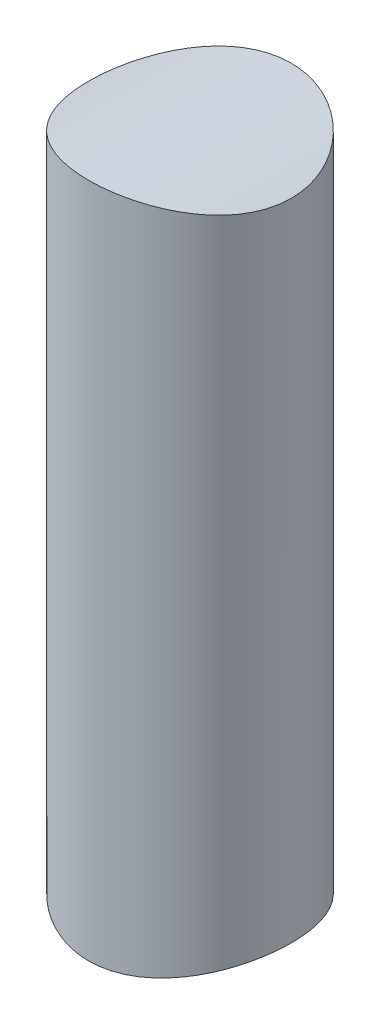
from build123d import *

# Parameters (mm, degrees)
CROQUIS1_R              = 2.5
SALIENTE_EXTRUIR1_DEPTH = 5
CROQUIS2_OUTSIDE_W      = 8.732
CROQUIS2_OUTSIDE_H      = 8.732
CROQUIS2_OUTSIDE_R      = 0.75
CORTAR_EXTRUIR1_DEPTH   = 2.5


with BuildPart() as part:
    # Croquis1 → Saliente-Extruir1 (new body)
    with BuildSketch(Plane.XY):
        Circle(CROQUIS1_R)
    extrude(amount=SALIENTE_EXTRUIR1_DEPTH)

    # Croquis2 outside → Cortar-Extruir1 (cut, symmetric)
    with BuildSketch(Plane(origin=(0, 0, 0), x_dir=(1, 0, 0), z_dir=(0, 1, 0))):
        with Locations((0, -2.5)):
            Rectangle(CROQUIS2_OUTSIDE_W, CROQUIS2_OUTSIDE_H)
        with Locations(Location((0, -2.5, 0), (0, 0, 270))):
            Circle(CROQUIS2_OUTSIDE_R, mode=Mode.SUBTRACT)
    extrude(amount=CORTAR_EXTRUIR1_DEPTH, both=True, mode=Mode.SUBTRACT)


solid = part.part
